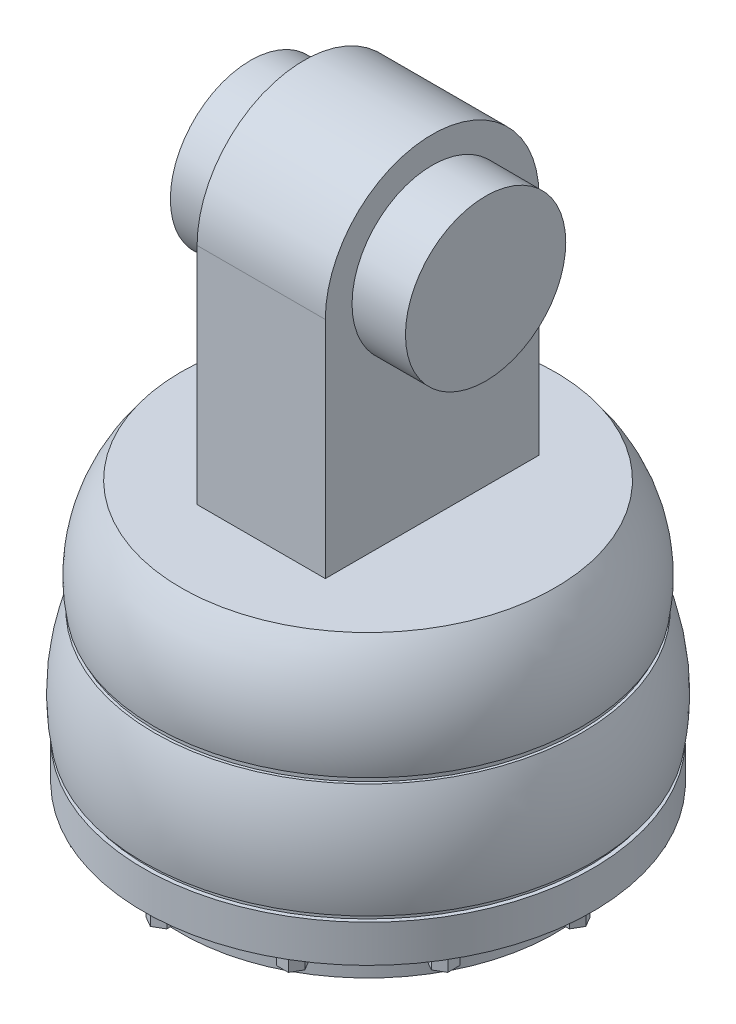
from build123d import *

# Parameters (mm, degrees)
SKETCH2_R            = 39.5
BOSS_EXTRUDE1_DEPTH  = 1
SKETCH4_R            = 41.25
BOSS_EXTRUDE2_DEPTH  = 1
SKETCH5_R            = 42
BOSS_EXTRUDE3_DEPTH  = 7
SKETCH6_R            = 35
BOSS_EXTRUDE4_DEPTH  = 7
BOSS_EXTRUDE5_DEPTH  = 3
CIRPATTERN1_COUNT    = 12
SKETCH8_R            = 15
BOSS_EXTRUDE6_DEPTH  = 10
SKETCH9_W            = 24
SKETCH9_H            = 40
BOSS_EXTRUDE7_DEPTH  = 42
BOSS_EXTRUDE8_START  = -24
BOSS_EXTRUDE8_DEPTH  = 24
SKETCH11_R           = 15
BOSS_EXTRUDE9_DEPTH  = 10
BOSS_EXTRUDE10_START = 10
SKETCH12_R           = 15
BOSS_EXTRUDE10_DEPTH = 10


with BuildPart() as part:
    # Sketch1 → Revolve1 (revolve)
    with BuildSketch(Plane.XY):
        with BuildLine():
            Line((0, 0), (-35, 0))
            ThreePointArc((-35, 0), (-39.657515479, -9.46062113), (-40, -20))
            Line((-40, -20), (0, -20))
            Line((0, -20), (0, 0))
        make_face()
    revolve(axis=Axis((0, 0, 0), (0, -1, 0)))

    # Sketch2 → Boss-Extrude1 (add)
    with BuildSketch(Plane.XZ.offset(20)):
        Circle(SKETCH2_R)
    extrude(amount=BOSS_EXTRUDE1_DEPTH)

    # Sketch3 → Revolve3 (revolve)
    with BuildSketch(Plane(origin=(0, 0, 0), x_dir=(0, 0, -1), z_dir=(1, 0, 0)), mode=Mode.PRIVATE) as revolve3_sk:
        with BuildLine():
            Line((0, -21), (-40, -21))
            ThreePointArc((-40, -21), (-42.384109041, -30.861589096), (-42, -41))
            Line((-42, -41), (0, -41))
            Line((0, -41), (0, -21))
        make_face()
    revolve(revolve3_sk.sketch.rotate(Axis((0, -21, 0), (0, -1, 0)), 90), axis=Axis((0, -21, 0), (0, -1, 0)))

    # Sketch4 → Boss-Extrude2 (add)
    with BuildSketch(Plane.XZ.offset(41)):
        with Locations(Location((0, 0, 0), (0, 0, 270))):
            Circle(SKETCH4_R)
    extrude(amount=BOSS_EXTRUDE2_DEPTH)

    # Sketch5 → Boss-Extrude3 (add)
    with BuildSketch(Plane.XZ.offset(42)):
        with Locations(Location((0, 0, 0), (0, 0, 270))):
            Circle(SKETCH5_R)
    extrude(amount=BOSS_EXTRUDE3_DEPTH)

    # Sketch6 → Boss-Extrude4 (add)
    with BuildSketch(Plane.XZ.offset(49)):
        with Locations(Location((0, 0, 0), (0, 0, 270))):
            Circle(SKETCH6_R)
    extrude(amount=BOSS_EXTRUDE4_DEPTH)

    # Sketch7 → Boss-Extrude5 (add)
    with BuildSketch(Plane.XZ.offset(49)):
        Polygon((36.25, 0), (37.375, -1.948557159), (39.625, -1.948557159), (40.75, 0), (39.625, 1.948557159), (37.375, 1.948557159), align=None)
        Polygon((37.952350269, 0.948557159), (37.404700538, 0), (37.952350269, -0.948557159), (39.047649731, -0.948557159), (39.595299462, 0), (39.047649731, 0.948557159), align=None, mode=Mode.SUBTRACT)
    boss_extrude5 = extrude(amount=BOSS_EXTRUDE5_DEPTH)

    # CirPattern1: Boss-Extrude5 ×12 about axis
    cirpattern1_axis = Axis((0, 0, 0), (0, 1, 0))
    for i in range(1, CIRPATTERN1_COUNT):
        add(boss_extrude5.rotate(cirpattern1_axis, i * 360 / CIRPATTERN1_COUNT))

    # Sketch8 → Boss-Extrude6 (add)
    with BuildSketch(Plane.XZ.offset(56)):
        with Locations(Location((0, 0, 0), (0, 0, 270))):
            Circle(SKETCH8_R)
    extrude(amount=BOSS_EXTRUDE6_DEPTH)

    # Sketch9 → Boss-Extrude7 (add)
    with BuildSketch(Plane(origin=(0, 0, 0), x_dir=(1, 0, 0), z_dir=(0, 1, 0))):
        Rectangle(SKETCH9_W, SKETCH9_H)
    extrude(amount=BOSS_EXTRUDE7_DEPTH)

    # Sketch10 → Boss-Extrude8 (add)
    with BuildSketch(Plane(origin=(12, 0, 0), x_dir=(0, 0, -1), z_dir=(1, 0, 0)).offset(BOSS_EXTRUDE8_START)):
        with BuildLine():
            Line((-20, 42), (20, 42))
            ThreePointArc((20, 42), (0, 62), (-20, 42))
        make_face()
    extrude(amount=BOSS_EXTRUDE8_DEPTH)

    # Sketch11 → Boss-Extrude9 (add)
    with BuildSketch(Plane(origin=(12, 0, 0), x_dir=(0, 0, -1), z_dir=(1, 0, 0))):
        with Locations(Location((0, 42, 0), (0, 0, 180))):
            Circle(SKETCH11_R)
    extrude(amount=BOSS_EXTRUDE9_DEPTH)

    # Sketch12 → Boss-Extrude10 (add)
    with BuildSketch(Plane.ZY.offset(12).offset(BOSS_EXTRUDE10_START)):
        with Locations((0, 42)):
            Circle(SKETCH12_R)
    extrude(amount=-BOSS_EXTRUDE10_DEPTH)


solid = part.part
